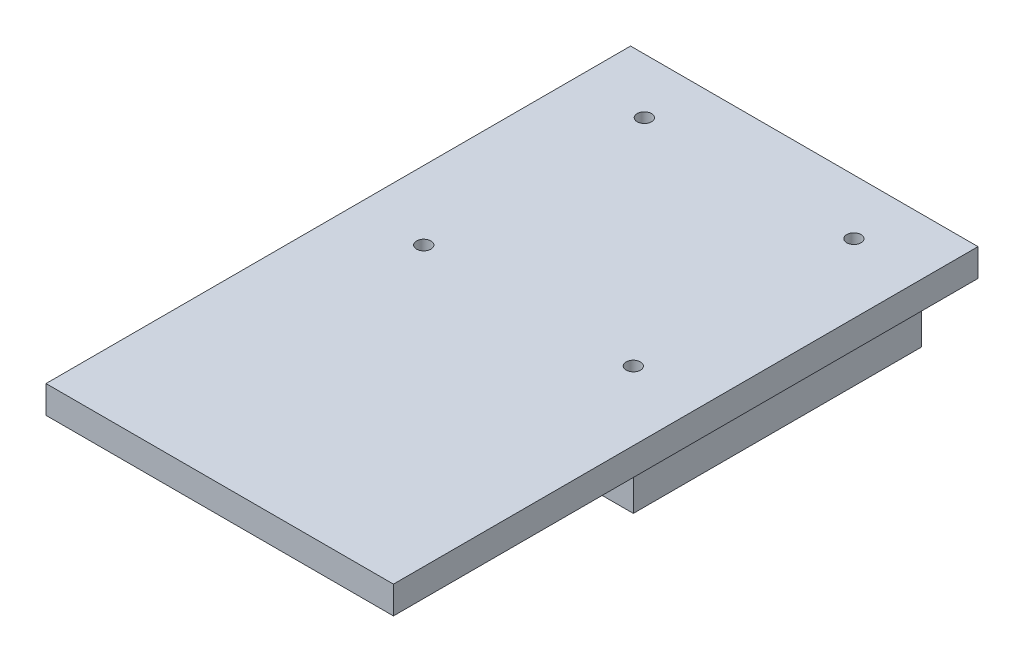
from build123d import *

# Parameters (mm, degrees)
SKETCH3_W           = 63
SKETCH3_H           = 60
BOSS_EXTRUDE3_DEPTH = 5
CUT_EXTRUDE1_REACH  = 56.314
SKETCH4_R           = 1.3
SKETCH9_R           = 4.55
SKETCH9_R_2         = 1.05
BOSS_EXTRUDE5_DEPTH = 6
SKETCH11_W          = 63
SKETCH11_H          = 5
BOSS_EXTRUDE7_DEPTH = 46
SKETCH12_W          = 50.3
SKETCH12_H          = 52.3
BOSS_EXTRUDE8_DEPTH = 12
SKETCH13_W          = 40
SKETCH13_H          = 12
CUT_EXTRUDE4_DEPTH  = 1.62


with BuildPart() as part:
    # Sketch3 → Boss-Extrude3 (new body)
    with BuildSketch(Plane(origin=(0, 0, 0), x_dir=(1, 0, 0), z_dir=(0, 1, 0))):
        with Locations((-13.5, 0)):
            Rectangle(SKETCH3_W, SKETCH3_H)
    extrude(amount=BOSS_EXTRUDE3_DEPTH)

    # Sketch4 → Cut-Extrude1 (cut, up to next)
    with BuildSketch(Plane(origin=(0, 5, 0), x_dir=(1, 0, 0), z_dir=(0, 1, 0)), mode=Mode.PRIVATE) as cut_extrude1_sk1:
        with Locations(Location((-32.5, 20, 0), (0, 0, 270))):
            Circle(SKETCH4_R)
    cut_extrude1_tool1 = extrude(cut_extrude1_sk1.sketch, amount=-CUT_EXTRUDE1_REACH, mode=Mode.PRIVATE) & part.part
    # Sketch4 → Cut-Extrude1 (cut, up to next)
    with BuildSketch(Plane(origin=(0, 5, 0), x_dir=(1, 0, 0), z_dir=(0, 1, 0)), mode=Mode.PRIVATE) as cut_extrude1_sk2:
        with Locations(Location((5.5, 20, 0), (0, 0, 270))):
            Circle(SKETCH4_R)
    cut_extrude1_tool2 = extrude(cut_extrude1_sk2.sketch, amount=-CUT_EXTRUDE1_REACH, mode=Mode.PRIVATE) & part.part
    # Sketch4 → Cut-Extrude1 (cut, up to next)
    with BuildSketch(Plane(origin=(0, 5, 0), x_dir=(1, 0, 0), z_dir=(0, 1, 0)), mode=Mode.PRIVATE) as cut_extrude1_sk3:
        with Locations(Location((5.5, -20, 0), (0, 0, 270))):
            Circle(SKETCH4_R)
    cut_extrude1_tool3 = extrude(cut_extrude1_sk3.sketch, amount=-CUT_EXTRUDE1_REACH, mode=Mode.PRIVATE) & part.part
    # Sketch4 → Cut-Extrude1 (cut, up to next)
    with BuildSketch(Plane(origin=(0, 5, 0), x_dir=(1, 0, 0), z_dir=(0, 1, 0)), mode=Mode.PRIVATE) as cut_extrude1_sk4:
        with Locations(Location((-32.5, -20, 0), (0, 0, 270))):
            Circle(SKETCH4_R)
    cut_extrude1_tool4 = extrude(cut_extrude1_sk4.sketch, amount=-CUT_EXTRUDE1_REACH, mode=Mode.PRIVATE) & part.part
    add(cut_extrude1_tool1.solids().sort_by_distance((-32.5, 5, -20))[0], mode=Mode.SUBTRACT)
    add(cut_extrude1_tool2.solids().sort_by_distance((5.5, 5, -20))[0], mode=Mode.SUBTRACT)
    add(cut_extrude1_tool3.solids().sort_by_distance((5.5, 5, 20))[0], mode=Mode.SUBTRACT)
    add(cut_extrude1_tool4.solids().sort_by_distance((-32.5, 5, 20))[0], mode=Mode.SUBTRACT)

    # Sketch9 → Boss-Extrude5 (add)
    # profile 1 of 4: a face of its own
    with BuildSketch(Plane.XZ):
        with Locations(Location((-32.5, 20, 0), (0, 0, 270))):
            Circle(SKETCH9_R)
        with Locations(Location((-32.5, 20, 0), (0, 0, 270))):
            Circle(SKETCH9_R_2, mode=Mode.SUBTRACT)
    # profile 2 of 4: a face of its own
    with BuildSketch(Plane.XZ):
        with Locations(Location((-32.5, -20, 0), (0, 0, 270))):
            Circle(SKETCH9_R)
        with Locations(Location((-32.5, -20, 0), (0, 0, 270))):
            Circle(SKETCH9_R_2, mode=Mode.SUBTRACT)
    # profile 3 of 4: a face of its own
    with BuildSketch(Plane.XZ):
        with Locations(Location((5.5, 20, 0), (0, 0, 270))):
            Circle(SKETCH9_R)
        with Locations(Location((5.5, 20, 0), (0, 0, 270))):
            Circle(SKETCH9_R_2, mode=Mode.SUBTRACT)
    # profile 4 of 4: a face of its own
    with BuildSketch(Plane.XZ):
        with Locations(Location((5.5, -20, 0), (0, 0, 270))):
            Circle(SKETCH9_R)
        with Locations(Location((5.5, -20, 0), (0, 0, 270))):
            Circle(SKETCH9_R_2, mode=Mode.SUBTRACT)
    extrude(amount=BOSS_EXTRUDE5_DEPTH)

    # Sketch11 → Boss-Extrude7 (add)
    with BuildSketch(Plane.XY.offset(30)):
        with Locations((-13.5, 2.5)):
            Rectangle(SKETCH11_W, SKETCH11_H)
    extrude(amount=BOSS_EXTRUDE7_DEPTH)

    # Sketch12 → Boss-Extrude8 (add)
    with BuildSketch(Plane.XZ):
        with Locations((-13.5, 0)):
            Rectangle(SKETCH12_W, SKETCH12_H)
        with BuildLine():
            Line((-32.889447937, 24.533302362), (5.889447937, 24.533302362))
            ThreePointArc((5.889447937, 24.533302362), (8.819595501, 23.319595501), (10.033302362, 20.389447937))
            Line((10.033302362, 20.389447937), (10.033302362, -20.389447937))
            ThreePointArc((10.033302362, -20.389447937), (8.819595501, -23.319595501), (5.889447937, -24.533302362))
            Line((5.889447937, -24.533302362), (-32.889447937, -24.533302362))
            ThreePointArc((-32.889447937, -24.533302362), (-35.819595501, -23.319595501), (-37.033302362, -20.389447937))
            Line((-37.033302362, -20.389447937), (-37.033302362, 20.389447937))
            ThreePointArc((-37.033302362, 20.389447937), (-35.819595501, 23.319595501), (-32.889447937, 24.533302362))
        make_face(mode=Mode.SUBTRACT)
    extrude(amount=BOSS_EXTRUDE8_DEPTH)

    # Sketch13 → Cut-Extrude4 (cut)
    with BuildSketch(Plane.ZY.offset(38.65)):
        with Locations((0, -6)):
            Rectangle(SKETCH13_W, SKETCH13_H)
    extrude(amount=-CUT_EXTRUDE4_DEPTH, mode=Mode.SUBTRACT)


solid = part.part
